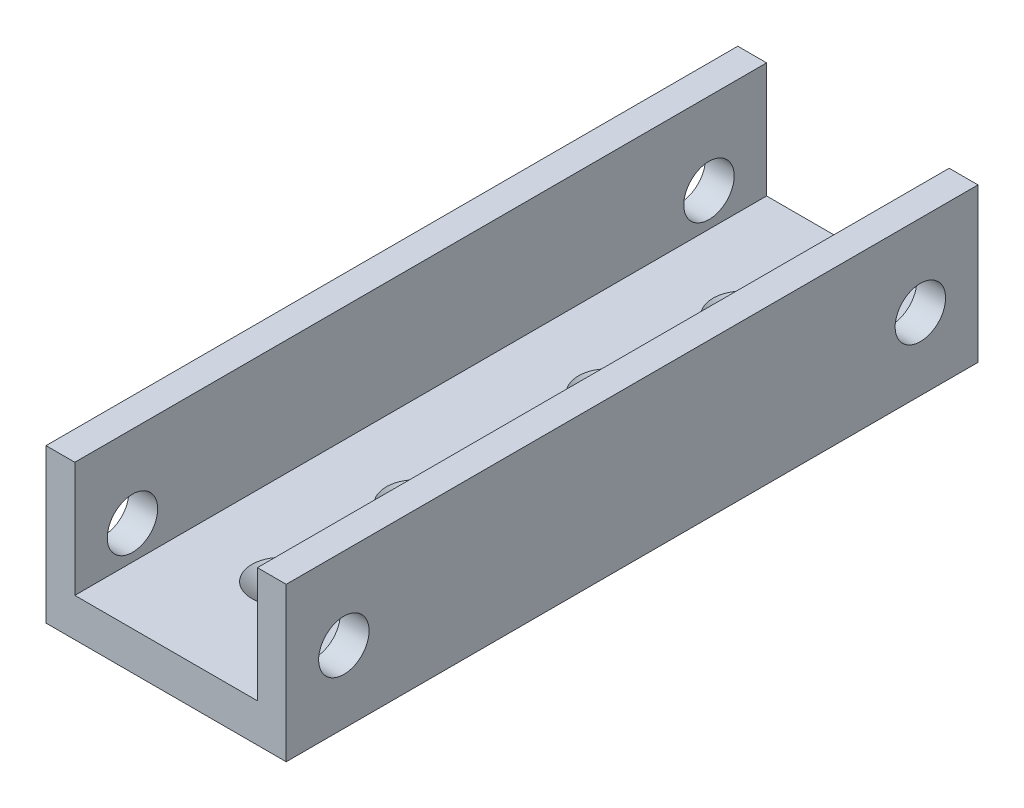
from build123d import *

# Parameters (mm, degrees)
BOSS_EXTRUDE1_DEPTH                                = 57.15
CSK_FOR_10_FLAT_HEAD_MACHINE_SCREW_100_D           = 5.1054
CSK_FOR_10_FLAT_HEAD_MACHINE_SCREW_100_CSINK_D     = 9.779
CSK_FOR_10_FLAT_HEAD_MACHINE_SCREW_100_CSINK_ANGLE = 100
SKETCH6_OUTSIDE_W                                  = 141.026
SKETCH6_OUTSIDE_H                                  = 52.126
SKETCH6_OUTSIDE_W_2                                = 114.3
SKETCH6_OUTSIDE_H_2                                = 25.4
SKETCH6_OUTSIDE_R                                  = 4.1671875
CUT_EXTRUDE2_DEPTH                                 = 75.070102985


with BuildPart() as part:
    # Sketch1 → Boss-Extrude1 (new, symmetric)
    with BuildSketch(Plane.XY):
        Polygon((-19.84375, 25.4), (-19.84375, 0), (19.84375, 0), (19.84375, 25.4), (15.08125, 25.4), (15.08125, 6.35), (-15.08125, 6.35), (-15.08125, 25.4), align=None)
    extrude(amount=BOSS_EXTRUDE1_DEPTH, both=True)

    # CSK for #10 Flat Head Machine Screw (100)1 (through all)
    with Locations(Plane(origin=(0, 6.35, 0), x_dir=(1, 0, 0), z_dir=(0, 1, 0))):
        with Locations((0, 15.875), (0, 38.1), (0, -15.875), (0, -38.1)):
            CounterSinkHole(CSK_FOR_10_FLAT_HEAD_MACHINE_SCREW_100_D / 2, CSK_FOR_10_FLAT_HEAD_MACHINE_SCREW_100_CSINK_D / 2, counter_sink_angle=CSK_FOR_10_FLAT_HEAD_MACHINE_SCREW_100_CSINK_ANGLE)

    # Sketch6 outside → Cut-Extrude2 (cut, through all)
    # profile 1 of 3: a face of its own
    with BuildSketch(Plane(origin=(19.84375, 0, 0), x_dir=(0, 0, -1), z_dir=(1, 0, 0))):
        with Locations((0, 12.7)):
            Rectangle(SKETCH6_OUTSIDE_W, SKETCH6_OUTSIDE_H)
        with Locations((0, 12.7)):
            Rectangle(SKETCH6_OUTSIDE_W_2, SKETCH6_OUTSIDE_H_2, mode=Mode.SUBTRACT)
    # profile 2 of 3: a face of its own
    with BuildSketch(Plane(origin=(19.84375, 0, 0), x_dir=(0, 0, -1), z_dir=(1, 0, 0))):
        with Locations(Location((-47.625, 11.90625, 0), (0, 0, 90))):
            Circle(SKETCH6_OUTSIDE_R)
    # profile 3 of 3: a face of its own
    with BuildSketch(Plane(origin=(19.84375, 0, 0), x_dir=(0, 0, -1), z_dir=(1, 0, 0))):
        with Locations(Location((47.625, 11.90625, 0), (0, 0, 90))):
            Circle(SKETCH6_OUTSIDE_R)
    extrude(amount=-CUT_EXTRUDE2_DEPTH, mode=Mode.SUBTRACT)


solid = part.part
